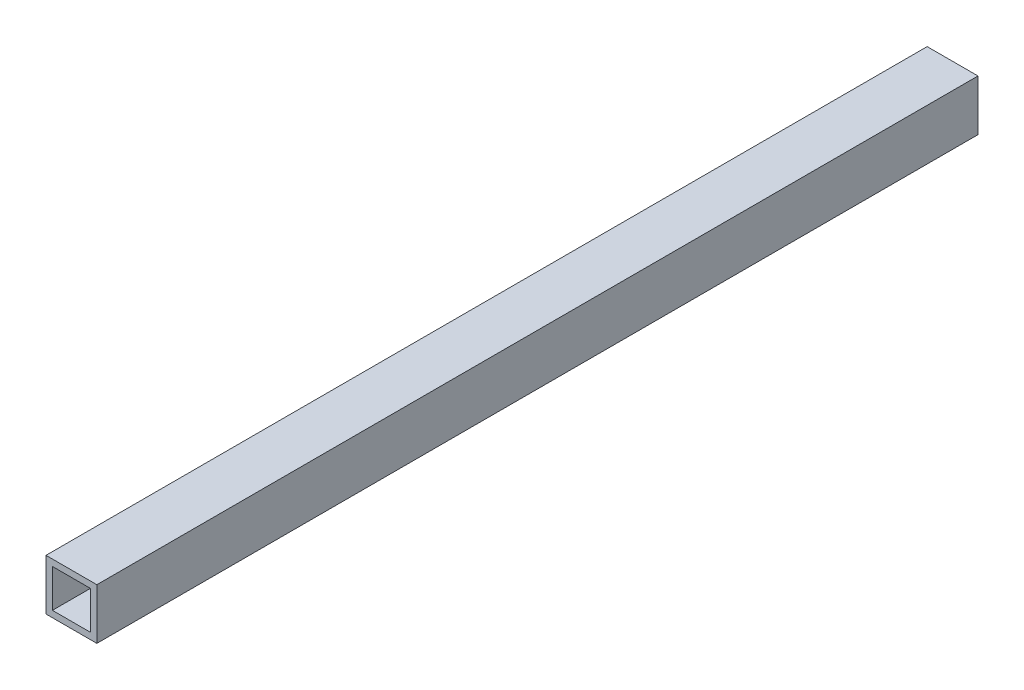
from build123d import *

# Parameters (mm, degrees)
SKETCH1_W           = 12.12
SKETCH1_H           = 12.12
SKETCH1_W_2         = 9.06
SKETCH1_H_2         = 9.06
BOSS_EXTRUDE1_DEPTH = 105


with BuildPart() as part:
    # Sketch1 → Boss-Extrude1 (new, symmetric)
    with BuildSketch(Plane.XY):
        Rectangle(SKETCH1_W, SKETCH1_H)
        Rectangle(SKETCH1_W_2, SKETCH1_H_2, mode=Mode.SUBTRACT)
    extrude(amount=BOSS_EXTRUDE1_DEPTH, both=True)


solid = part.part
